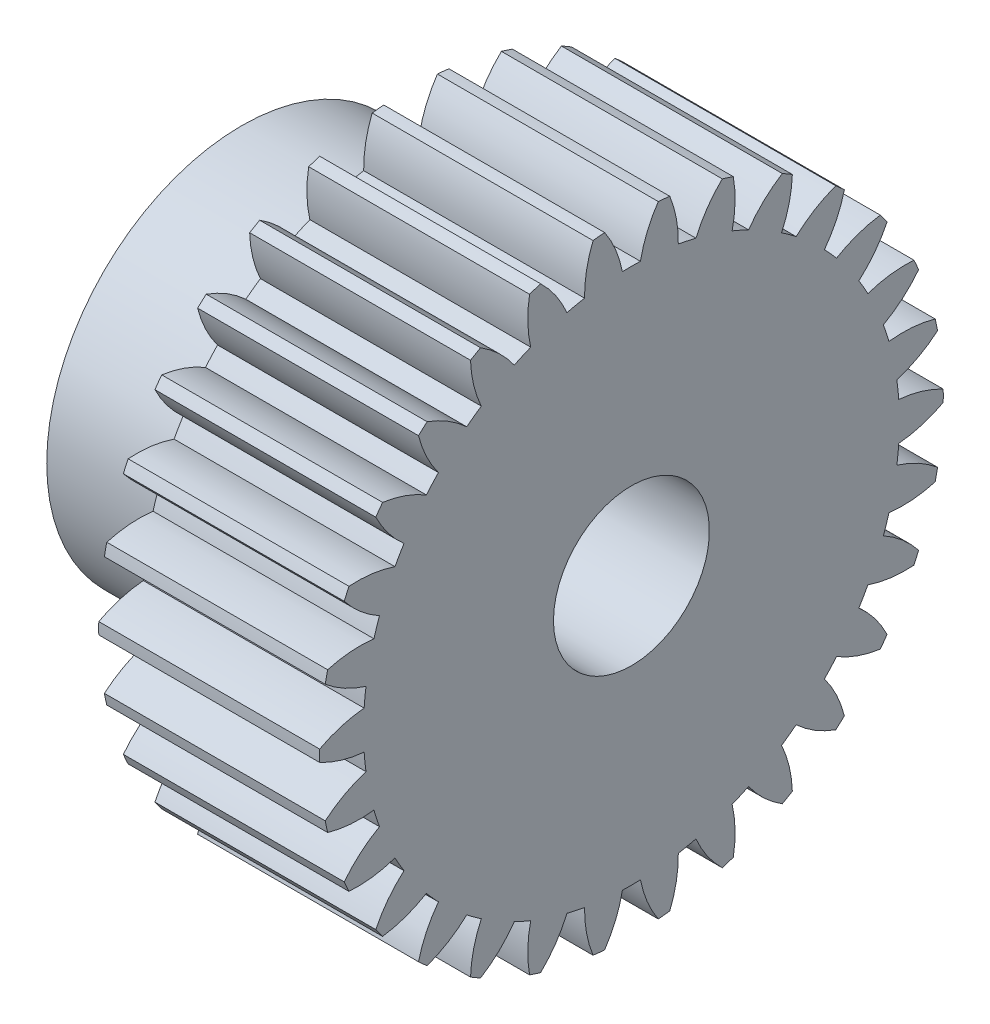
from build123d import *

# Parameters (mm, degrees)
BASPROSKE_W      = 17
BASPROSKE_H      = 24
TOOTHCUT_DEPTH   = 38.960505792
TEETHCUTS_COUNT  = 30
TEETHCUTS_ANGLE  = 348
HUBNEAONESKE_R   = 15
HUBNEARONE_DEPTH = 13.0000508
BORSKE_R         = 6
BORE_DEPTH       = 30.0000508


with BuildPart() as part:
    # BasProSke → Base-Revolve (revolve)
    with BuildSketch(Plane(origin=(0, 0, 0), x_dir=(1, 0, 0), z_dir=(0, 1, 0)), mode=Mode.PRIVATE) as base_revolve_sk:
        with Locations((8.5, 12)):
            Rectangle(BASPROSKE_W, BASPROSKE_H)
    revolve(base_revolve_sk.sketch.rotate(Axis((-10, 0, 0), (1, 0, 0)), 180), axis=Axis((-10, 0, 0), (1, 0, 0)))

    # TooCutSke → ToothCut (cut, through all)
    with BuildSketch(Plane(origin=(0, 0, 0), x_dir=(0, 0, -1), z_dir=(1, 0, 0))):
        with BuildLine():
            ThreePointArc((0.693278797, 20.612344372), (0, 20.624), (-0.693278797, 20.612344372))
            ThreePointArc((-0.693278797, 20.612344372), (-1.219042225, 22.34383125), (-2.080549663, 23.935144835))
            ThreePointArc((-2.080549663, 23.935144835), (0, 24.0254), (2.080549663, 23.935144835))
            ThreePointArc((2.080549663, 23.935144835), (1.219042225, 22.34383125), (0.693278797, 20.612344372))
        make_face()
    toothcut = extrude(amount=TOOTHCUT_DEPTH, mode=Mode.SUBTRACT)

    # TeethCuts: ToothCut ×30 about axis
    teethcuts_axis = Axis((-10, 0, 0), (1, 0, 0))
    for i in range(1, TEETHCUTS_COUNT):
        add(toothcut.rotate(teethcuts_axis, i * TEETHCUTS_ANGLE / (TEETHCUTS_COUNT - 1)), mode=Mode.SUBTRACT)

    # HubNeaOneSke → HubNearOne (add)
    with BuildSketch(Plane.ZY):
        with Locations(Location((0, 0, 0), (0, 0, 180))):
            Circle(HUBNEAONESKE_R)
    extrude(amount=HUBNEARONE_DEPTH)

    # BorSke → Bore (cut, symmetric)
    with BuildSketch(Plane(origin=(0, 0, 0), x_dir=(0, 0, -1), z_dir=(1, 0, 0))):
        with Locations(Location((0, 0, 0), (0, 0, 180))):
            Circle(BORSKE_R)
    extrude(amount=BORE_DEPTH, both=True, mode=Mode.SUBTRACT)


solid = part.part
